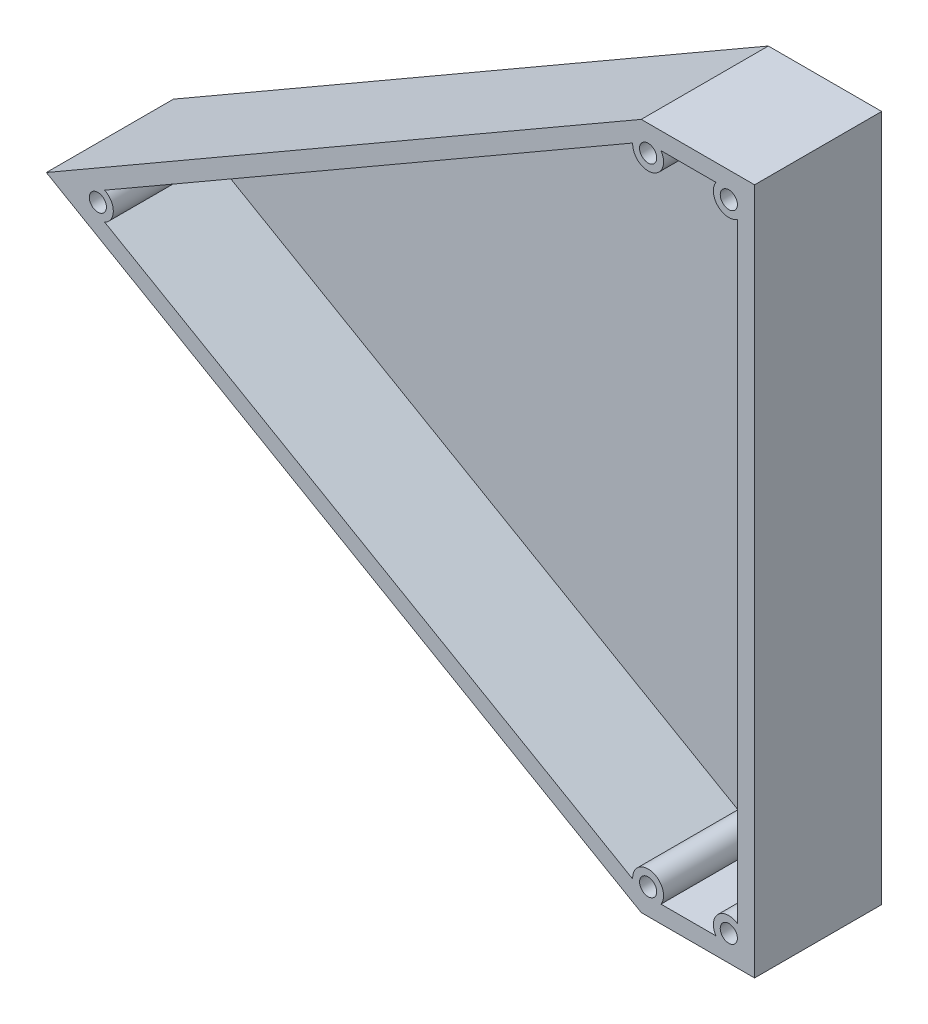
from build123d import *

# Parameters (mm, degrees)
BOSS_EXTRUDE1_DEPTH = 5
SKETCH2_R           = 2.5
BOSS_EXTRUDE2_DEPTH = 32


with BuildPart() as part:
    # Sketch1 → Boss-Extrude1 (new body)
    with BuildSketch(Plane.XY):
        Polygon((-30.5, -200), (-203.705080757, -100), (-30.5, 0), (2.5, 0), (2.5, -200), align=None)
    extrude(amount=BOSS_EXTRUDE1_DEPTH)

    # Sketch2 → Boss-Extrude2 (add)
    with BuildSketch(Plane.XY.offset(5)):
        Polygon((-203.705080757, -100), (-30.5, -200), (2.5, -200), (2.5, 0), (-30.5, 0), align=None)
        with Locations((-188.705080757, -100)):
            Circle(SKETCH2_R, mode=Mode.SUBTRACT)
        with Locations((-5, -192.5)):
            Circle(SKETCH2_R, mode=Mode.SUBTRACT)
        with Locations(Location((-5, -7.5, 0), (0, 0, 180))):
            Circle(SKETCH2_R, mode=Mode.SUBTRACT)
        with Locations((-28.490381057, -192.5)):
            Circle(SKETCH2_R, mode=Mode.SUBTRACT)
        with Locations(Location((-28.490381057, -7.5, 0), (0, 0, 180))):
            Circle(SKETCH2_R, mode=Mode.SUBTRACT)
        with BuildLine():
            Line((-8.741657387, -5), (-24.74872367, -5))
            ThreePointArc((-24.74872367, -5), (-27.325695354, -11.846666218), (-32.980751406, -7.205765184))
            Line((-32.980751406, -7.205765184), (-186.714710408, -95.964107797))
            ThreePointArc((-186.714710408, -95.964107797), (-184.205080757, -100), (-186.714710408, -104.035892203))
            Line((-186.714710408, -104.035892203), (-32.980751406, -192.794234816))
            ThreePointArc((-32.980751406, -192.794234816), (-27.325695354, -188.153333782), (-24.74872367, -195))
            Line((-24.74872367, -195), (-8.741657387, -195))
            ThreePointArc((-8.741657387, -195), (-8.181980515, -189.318019485), (-2.5, -188.758342613))
            Line((-2.5, -188.758342613), (-2.5, -11.241657387))
            ThreePointArc((-2.5, -11.241657387), (-8.181980515, -10.681980515), (-8.741657387, -5))
        make_face(mode=Mode.SUBTRACT)
    extrude(amount=BOSS_EXTRUDE2_DEPTH)


solid = part.part
